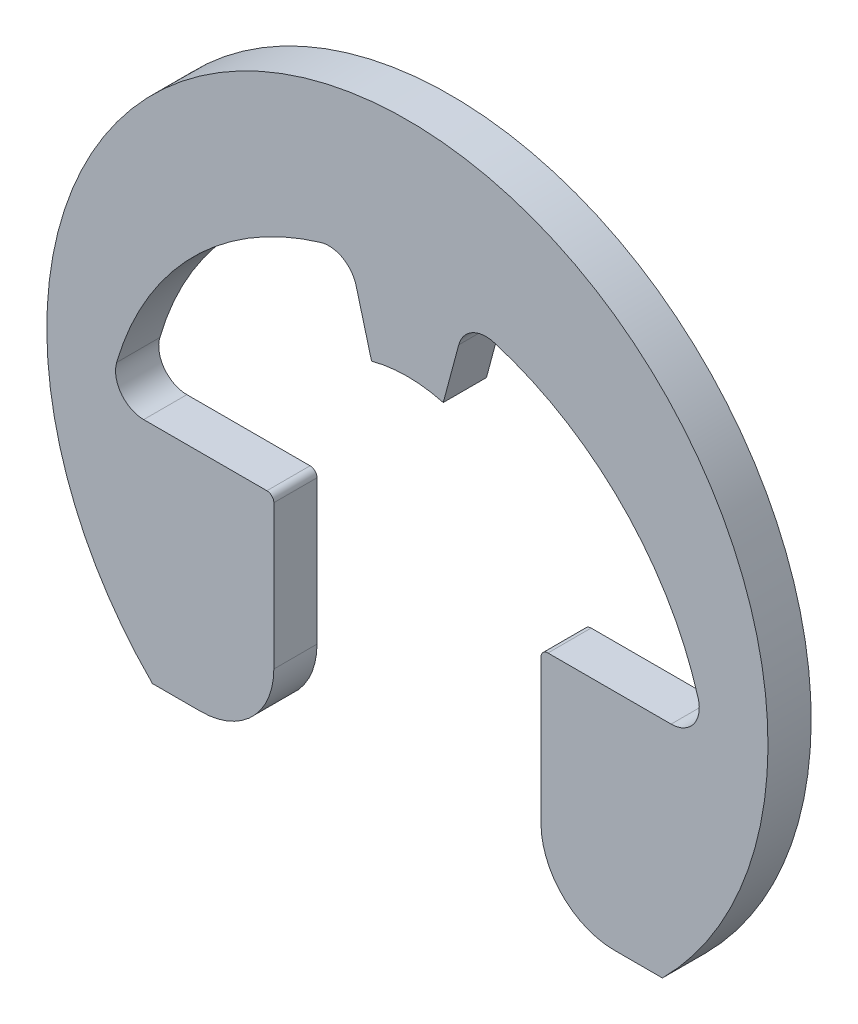
from build123d import *

# Parameters (mm, degrees)
BODY_DEPTH = 0.6


with BuildPart() as part:
    # BodySke → Body (new body)
    with BuildSketch(Plane.XY):
        with BuildLine():
            Line((3.542798702, -3.542798702), (2.874267987, -3.542798702))
            ThreePointArc((2.874267987, -3.542798702), (2.154333999, -3.244592279), (1.856127576, -2.524658291))
            Line((1.856127576, -2.524658291), (1.856127576, -0.523137995))
            ThreePointArc((1.856127576, -0.523137995), (1.884318549, -0.455078967), (1.952377576, -0.426887995))
            Line((1.952377576, -0.426887995), (3.664158868, -0.426887995))
            ThreePointArc((3.664158868, -0.426887995), (3.976794043, -0.270800915), (4.039911091, 0.072885231))
            ThreePointArc((4.039911091, 0.072885231), (2.986408887, 1.865726167), (1.202703544, 2.934623154))
            ThreePointArc((1.202703544, 2.934623154), (0.900072735, 2.901285473), (0.713027436, 2.661054618))
            Line((0.713027436, 2.661054618), (0.498226662, 1.859407216))
            ThreePointArc((0.498226662, 1.859407216), (0, 1.925), (-0.498226662, 1.859407216))
            Line((-0.498226662, 1.859407216), (-0.713027436, 2.661054618))
            ThreePointArc((-0.713027436, 2.661054618), (-0.900072735, 2.901285473), (-1.202703544, 2.934623154))
            ThreePointArc((-1.202703544, 2.934623154), (-2.986408887, 1.865726167), (-4.039911091, 0.072885231))
            ThreePointArc((-4.039911091, 0.072885231), (-3.976794043, -0.270800915), (-3.664158868, -0.426887995))
            Line((-3.664158868, -0.426887995), (-1.952377576, -0.426887995))
            ThreePointArc((-1.952377576, -0.426887995), (-1.884318549, -0.455078967), (-1.856127576, -0.523137995))
            Line((-1.856127576, -0.523137995), (-1.856127576, -2.524658291))
            ThreePointArc((-1.856127576, -2.524658291), (-2.154333999, -3.244592279), (-2.874267987, -3.542798702))
            Line((-2.874267987, -3.542798702), (-3.542798702, -3.542798702))
            ThreePointArc((-3.542798702, -3.542798702), (0, 5.010273973), (3.542798702, -3.542798702))
        make_face()
    extrude(amount=-BODY_DEPTH)


solid = part.part
